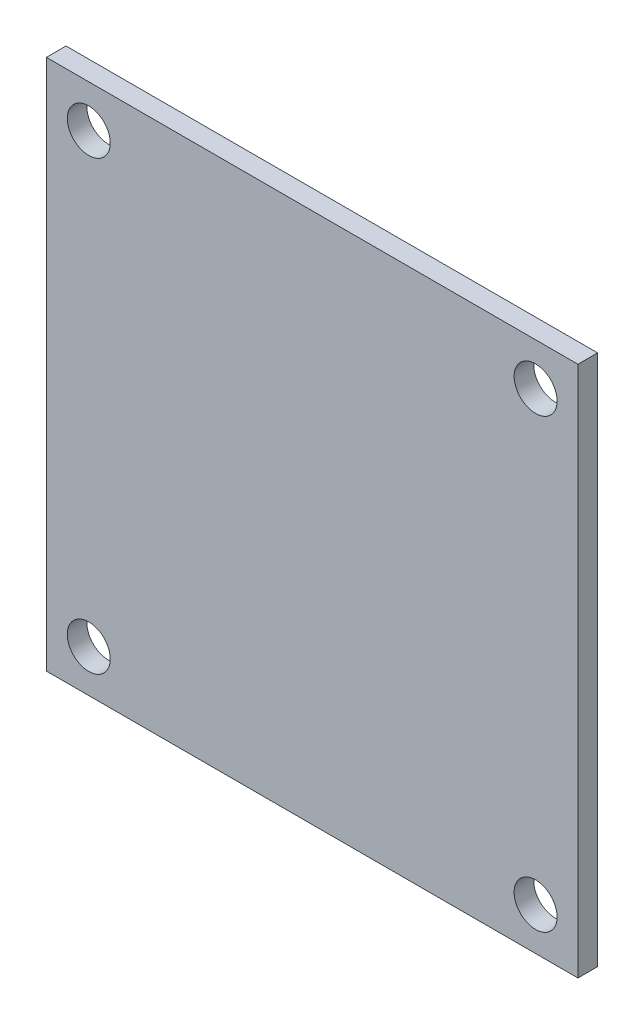
from build123d import *

# Parameters (mm, degrees)
ESQUISSE1_W               = 43.3
ESQUISSE1_H               = 43.3
BOSS_EXTRU_1_DEPTH        = 1.6
ESQUISSE2_R               = 1.75
ENL_V_MAT_EXTRU_1_DEPTH   = 62.25634661
SYM_TRIE2_COPY_1_SKETCH_R = 1.75
SYM_TRIE2_COPY_1_DEPTH    = 62.25634661


with BuildPart() as part:
    # Esquisse1 → Boss.-Extru.1 (new body)
    with BuildSketch(Plane.XY):
        with Locations((21.65, 21.65)):
            Rectangle(ESQUISSE1_W, ESQUISSE1_H)
    extrude(amount=BOSS_EXTRU_1_DEPTH)

    # Esquisse2 → Enlèv. mat.-Extru.1 (cut, through all)
    with BuildSketch(Plane.XY.offset(1.6)):
        with Locations((3.45, 39.85)):
            Circle(ESQUISSE2_R)
    enl_v_mat_extru_1 = extrude(amount=-ENL_V_MAT_EXTRU_1_DEPTH, mode=Mode.SUBTRACT)

    # Symétrie1: Enlèv. mat.-Extru.1 across plane
    add(enl_v_mat_extru_1.mirror(Plane.ZY.offset(-21.65)), mode=Mode.SUBTRACT)

    # Symétrie2: Enlèv. mat.-Extru.1 across plane
    add(enl_v_mat_extru_1.mirror(Plane.ZX.offset(21.65)), mode=Mode.SUBTRACT)

    # Symétrie2 copy 1 sketch → Symétrie2 copy 1 (cut, through all)
    with BuildSketch(Plane(origin=(43.3, 43.3, 1.6), x_dir=(-1, 0, 0), z_dir=(0, 0, 1))):
        with Locations((3.45, 39.85)):
            Circle(SYM_TRIE2_COPY_1_SKETCH_R)
    extrude(amount=-SYM_TRIE2_COPY_1_DEPTH, mode=Mode.SUBTRACT)


solid = part.part
